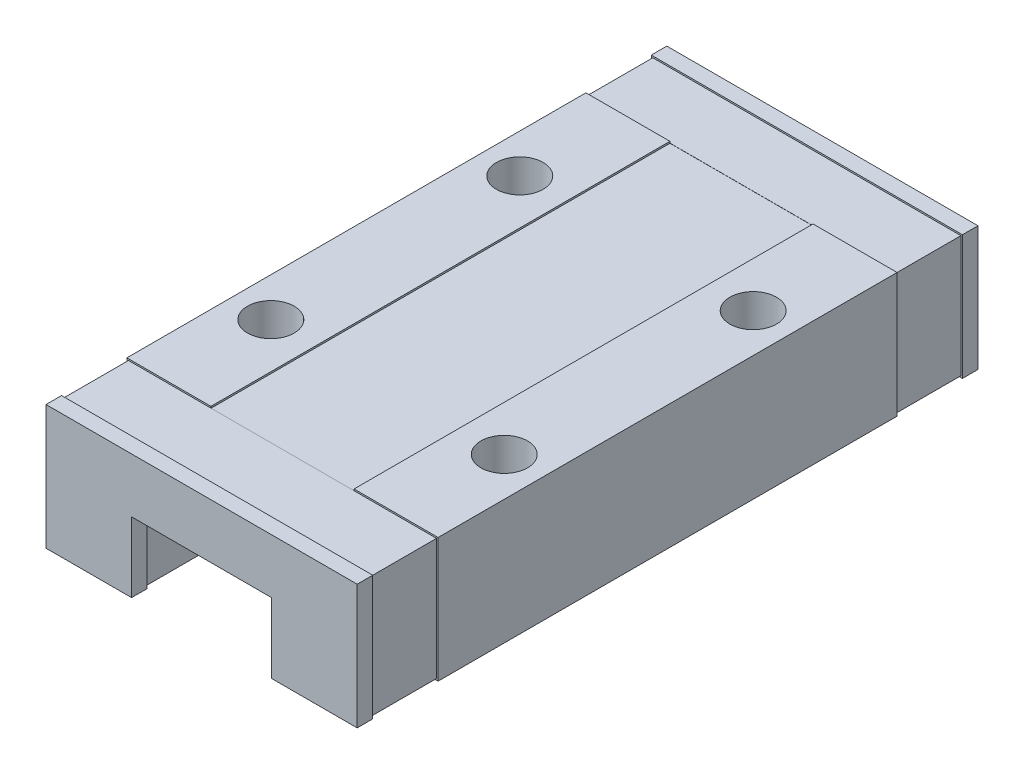
from build123d import *

# Parameters (mm, degrees)
BOSS_EXTRUDE1_DEPTH = 39.9
SKETCH2_R           = 1.5
CUT_EXTRUDE1_DEPTH  = 4
CUT_EXTRUDE2_DEPTH  = 5.2
CUT_EXTRUDE3_START  = -39.9
CUT_EXTRUDE3_DEPTH  = 5.2
BOSS_EXTRUDE2_DEPTH = 1
BOSS_EXTRUDE3_START = -39.9
BOSS_EXTRUDE3_DEPTH = 1
SKETCH5_W           = 9.2
SKETCH5_H           = 29.5
CUT_EXTRUDE4_DEPTH  = 0.11


with BuildPart() as part:
    # Sketch1 → Boss-Extrude1 (new body)
    with BuildSketch(Plane.XY):
        Polygon((4.5, 4.5), (-4.5, 4.5), (-4.5, 0), (-10, 0), (-10, 8), (10, 8), (10, 0), (4.5, 0), align=None)
    extrude(amount=BOSS_EXTRUDE1_DEPTH)

    # Sketch2 → Cut-Extrude1 (cut)
    with BuildSketch(Plane(origin=(0, 8, 0), x_dir=(1, 0, 0), z_dir=(0, 1, 0))):
        with Locations(Location((-7.5, -11.95, 0), (0, 0, 180))):
            Circle(SKETCH2_R)
        with Locations((7.5, -11.95)):
            Circle(SKETCH2_R)
        with Locations(Location((7.5, -27.95, 0), (0, 0, 180))):
            Circle(SKETCH2_R)
        with Locations((-7.5, -27.95)):
            Circle(SKETCH2_R)
    extrude(amount=-CUT_EXTRUDE1_DEPTH, mode=Mode.SUBTRACT)

    # Sketch3 → Cut-Extrude2 (cut)
    with BuildSketch(Plane(origin=(0, 0, 0), x_dir=(-1, 0, 0), z_dir=(0, 0, -1))):
        Polygon((4.5, 0), (10, 0), (10, 8), (-10, 8), (-10, 0), (-4.5, 0), (-4.5, 4.5), (4.5, 4.5), align=None)
        Polygon((4.6, 0.1), (9.9, 0.1), (9.9, 7.9), (-9.9, 7.9), (-9.9, 0.1), (-4.6, 0.1), (-4.6, 4.6), (4.6, 4.6), align=None, mode=Mode.SUBTRACT)
    extrude(amount=-CUT_EXTRUDE2_DEPTH, mode=Mode.SUBTRACT)

    # Sketch3<3> → Cut-Extrude3 (cut)
    with BuildSketch(Plane(origin=(0, 0, 0), x_dir=(-1, 0, 0), z_dir=(0, 0, -1)).offset(CUT_EXTRUDE3_START)):
        Polygon((10, 0), (10, 8), (-10, 8), (-10, 0), (-4.5, 0), (-4.5, 4.5), (4.5, 4.5), (4.5, 0), align=None)
        Polygon((9.9, 0.1), (9.9, 7.9), (-9.9, 7.9), (-9.9, 0.1), (-4.6, 0.1), (-4.6, 4.6), (4.6, 4.6), (4.6, 0.1), align=None, mode=Mode.SUBTRACT)
    extrude(amount=CUT_EXTRUDE3_DEPTH, mode=Mode.SUBTRACT)

    # Sketch4 → Boss-Extrude2 (add)
    with BuildSketch(Plane(origin=(0, 0, 0), x_dir=(-1, 0, 0), z_dir=(0, 0, -1))):
        Polygon((4.5, 4.5), (4.5, 0), (10, 0), (10, 8), (-10, 8), (-10, 0), (-4.5, 0), (-4.5, 4.5), align=None)
    extrude(amount=-BOSS_EXTRUDE2_DEPTH)

    # Sketch4<2> → Boss-Extrude3 (add)
    with BuildSketch(Plane(origin=(0, 0, 0), x_dir=(-1, 0, 0), z_dir=(0, 0, -1)).offset(BOSS_EXTRUDE3_START)):
        Polygon((4.5, 4.5), (4.5, 0), (10, 0), (10, 8), (-10, 8), (-10, 0), (-4.5, 0), (-4.5, 4.5), align=None)
    extrude(amount=BOSS_EXTRUDE3_DEPTH)

    # Sketch5 → Cut-Extrude4 (cut)
    with BuildSketch(Plane(origin=(0, 8, 0), x_dir=(1, 0, 0), z_dir=(0, 1, 0))):
        with Locations((0, -19.95)):
            Rectangle(SKETCH5_W, SKETCH5_H)
    extrude(amount=-CUT_EXTRUDE4_DEPTH, mode=Mode.SUBTRACT)


solid = part.part
